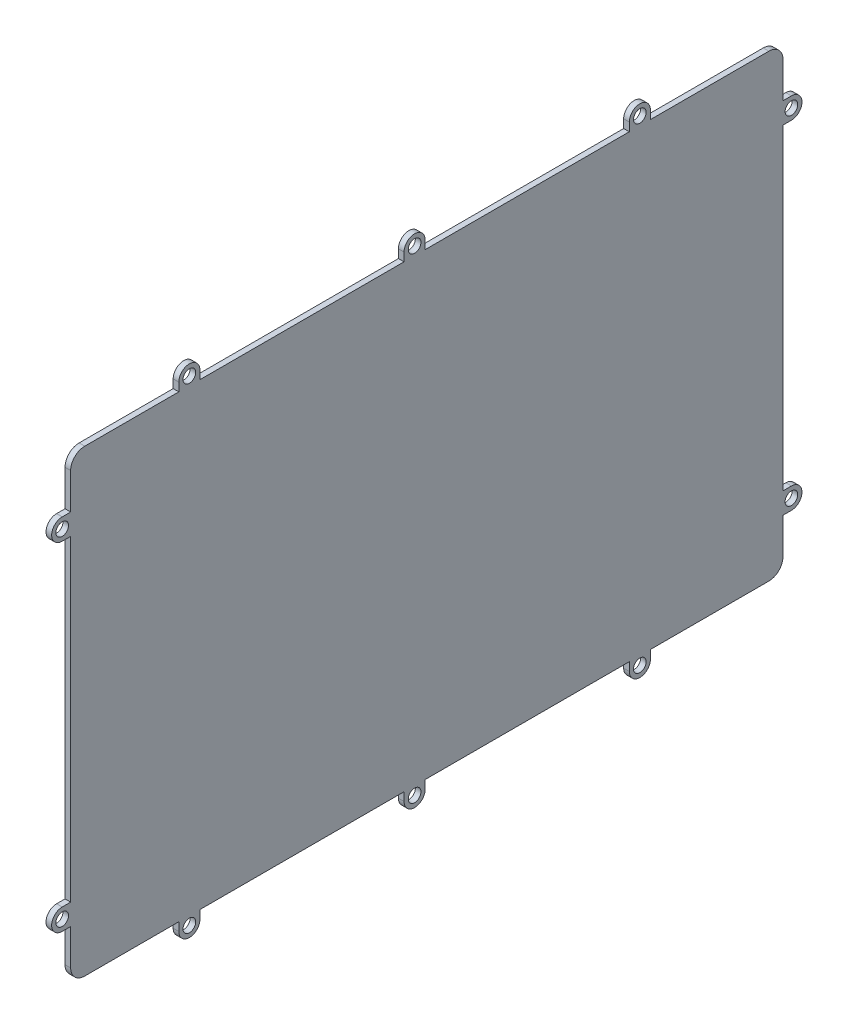
from build123d import *

# Parameters (mm, degrees)
IZIM2_R                     = 1.6
Y_KSEKLIK_EKSTR_ZYON1_DEPTH = 2
IZIM3_R                     = 2.25
KES_EKSTR_ZYON1_DEPTH       = 2


with BuildPart() as part:
    # Çizim2 → Yükseklik-Ekstrüzyon1 (new body)
    with BuildSketch(Plane.YZ):
        with BuildLine():
            Line((-77.099299539, -127.848423963), (-64.349299539, -127.848423963))
            Line((-64.349299539, -127.848423963), (-64.349299539, -130.848423963))
            ThreePointArc((-64.349299539, -130.848423963), (-60.599299539, -134.598423963), (-56.849299539, -130.848423963))
            Line((-56.849299539, -130.848423963), (-56.849299539, -127.848423963))
            Line((-56.849299539, -127.848423963), (55.650700461, -127.848423963))
            Line((55.650700461, -127.848423963), (55.650700461, -130.848423963))
            ThreePointArc((55.650700461, -130.848423963), (59.400700461, -134.598423963), (63.150700461, -130.848423963))
            Line((63.150700461, -130.848423963), (63.150700461, -127.848423963))
            Line((63.150700461, -127.848423963), (75.900700461, -127.848423963))
            ThreePointArc((75.900700461, -127.848423963), (79.436234367, -126.383957869), (80.900700461, -122.848423963))
            Line((80.900700461, -122.848423963), (80.900700461, -80.764464123))
            Line((80.900700461, -80.764464123), (83.900700461, -80.764464123))
            ThreePointArc((83.900700461, -80.764464123), (87.650700461, -77.014464123), (83.900700461, -73.264464123))
            Line((83.900700461, -73.264464123), (80.900700461, -73.264464123))
            Line((80.900700461, -73.264464123), (80.900700461, -0.764464123))
            Line((80.900700461, -0.764464123), (83.900700461, -0.764464123))
            ThreePointArc((83.900700461, -0.764464123), (87.650700461, 2.985535877), (83.900700461, 6.735535877))
            Line((83.900700461, 6.735535877), (80.900700461, 6.735535877))
            Line((80.900700461, 6.735535877), (80.900700461, 79.235535877))
            Line((80.900700461, 79.235535877), (83.900700461, 79.235535877))
            ThreePointArc((83.900700461, 79.235535877), (87.650700461, 82.985535877), (83.900700461, 86.735535877))
            Line((83.900700461, 86.735535877), (80.900700461, 86.735535877))
            Line((80.900700461, 86.735535877), (80.900700461, 120.151576037))
            ThreePointArc((80.900700461, 120.151576037), (79.436234367, 123.687109943), (75.900700461, 125.151576037))
            Line((75.900700461, 125.151576037), (63.150700461, 125.151576037))
            Line((63.150700461, 125.151576037), (63.150700461, 128.151576037))
            ThreePointArc((63.150700461, 128.151576037), (59.400700461, 131.901576037), (55.650700461, 128.151576037))
            Line((55.650700461, 128.151576037), (55.650700461, 125.151576037))
            Line((55.650700461, 125.151576037), (-56.849299539, 125.151576037))
            Line((-56.849299539, 125.151576037), (-56.849299539, 128.151576037))
            ThreePointArc((-56.849299539, 128.151576037), (-60.599299539, 131.901576037), (-64.349299539, 128.151576037))
            Line((-64.349299539, 128.151576037), (-64.349299539, 125.151576037))
            Line((-64.349299539, 125.151576037), (-77.099299539, 125.151576037))
            ThreePointArc((-77.099299539, 125.151576037), (-80.634833445, 123.687109943), (-82.099299539, 120.151576037))
            Line((-82.099299539, 120.151576037), (-82.099299539, 86.735535877))
            Line((-82.099299539, 86.735535877), (-85.099299539, 86.735535877))
            ThreePointArc((-85.099299539, 86.735535877), (-88.849299539, 82.985535877), (-85.099299539, 79.235535877))
            Line((-85.099299539, 79.235535877), (-82.099299539, 79.235535877))
            Line((-82.099299539, 79.235535877), (-82.099299539, 6.735535877))
            Line((-82.099299539, 6.735535877), (-85.099299539, 6.735535877))
            ThreePointArc((-85.099299539, 6.735535877), (-88.849299539, 2.985535877), (-85.099299539, -0.764464123))
            Line((-85.099299539, -0.764464123), (-82.099299539, -0.764464123))
            Line((-82.099299539, -0.764464123), (-82.099299539, -73.264464123))
            Line((-82.099299539, -73.264464123), (-85.099299539, -73.264464123))
            ThreePointArc((-85.099299539, -73.264464123), (-88.849299539, -77.014464123), (-85.099299539, -80.764464123))
            Line((-85.099299539, -80.764464123), (-82.099299539, -80.764464123))
            Line((-82.099299539, -80.764464123), (-82.099299539, -122.848423963))
            ThreePointArc((-82.099299539, -122.848423963), (-80.634833445, -126.383957869), (-77.099299539, -127.848423963))
        make_face()
        with Locations(Location((-85.099299539, 82.985535877, 0), (0, 0, 270))):
            Circle(IZIM2_R, mode=Mode.SUBTRACT)
        with Locations(Location((-85.099299539, 2.985535877, 0), (0, 0, 270))):
            Circle(IZIM2_R, mode=Mode.SUBTRACT)
        with Locations(Location((-85.099299539, -77.014464123, 0), (0, 0, 270))):
            Circle(IZIM2_R, mode=Mode.SUBTRACT)
        with Locations(Location((-60.599299539, -130.848423963, 0), (0, 0, 270))):
            Circle(IZIM2_R, mode=Mode.SUBTRACT)
        with Locations(Location((59.400700461, -130.848423963, 0), (0, 0, 270))):
            Circle(IZIM2_R, mode=Mode.SUBTRACT)
        with Locations(Location((83.900700461, -77.014464123, 0), (0, 0, 270))):
            Circle(IZIM2_R, mode=Mode.SUBTRACT)
        with Locations(Location((83.900700461, 2.985535877, 0), (0, 0, 270))):
            Circle(IZIM2_R, mode=Mode.SUBTRACT)
        with Locations(Location((83.900700461, 82.985535877, 0), (0, 0, 270))):
            Circle(IZIM2_R, mode=Mode.SUBTRACT)
        with Locations(Location((59.400700461, 128.151576037, 0), (0, 0, 270))):
            Circle(IZIM2_R, mode=Mode.SUBTRACT)
        with Locations(Location((-60.599299539, 128.151576037, 0), (0, 0, 270))):
            Circle(IZIM2_R, mode=Mode.SUBTRACT)
    extrude(amount=Y_KSEKLIK_EKSTR_ZYON1_DEPTH)

    # Çizim3 → Kes-Ekstrüzyon1 (cut)
    with BuildSketch(Plane.YZ.offset(2)):
        with Locations(Location((-60.599299539, 128.151576037, 0), (0, 0, 270))):
            Circle(IZIM3_R)
    kes_ekstr_zyon1 = extrude(amount=-KES_EKSTR_ZYON1_DEPTH, mode=Mode.SUBTRACT)

    # Çizim-Çoğaltma1: Kes-Ekstrüzyon1 at 10 more places
    with Locations((0, 120, 0), (0, 144.5, -45.16604), (0, 144.5, -125.16604), (0, 144.5, -205.16604), (0, 120, -259), (0, 0, -259), (0, -24.5, -205.16604), (0, -24.5, -125.16604), (0, -24.5, -45.16604), (0, -147.335631, 64.588173)):
        add(kes_ekstr_zyon1, mode=Mode.SUBTRACT)


solid = part.part
